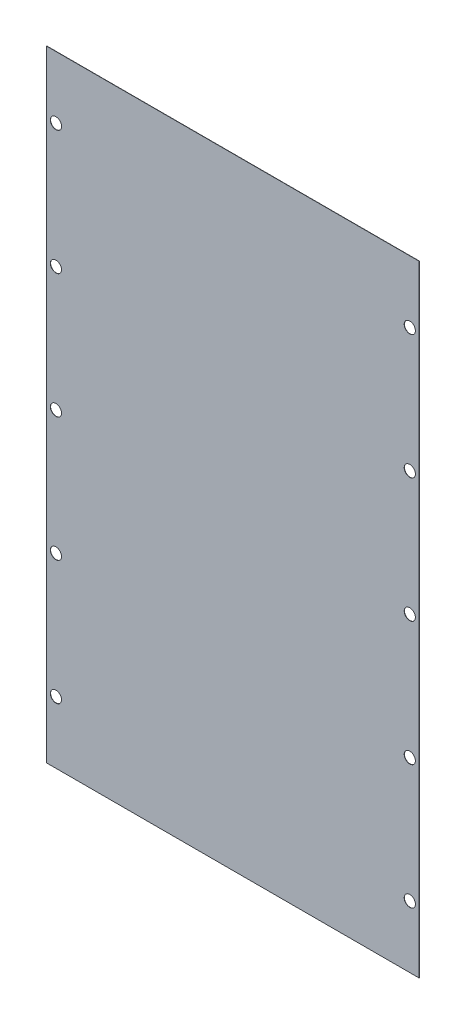
from build123d import *

# Parameters (mm, degrees)
SKETCH1_W                   = 300
SKETCH1_H                   = 500
BOSS_EXTRUDE1_DEPTH         = 0.2
SKETCH2_R                   = 4.499999998
SKETCH2_R_2                 = 4.500000002
M8_CLEARANCE_9MM_THRU_DEPTH = 801.390554667


with BuildPart() as part:
    # Sketch1 → Boss-Extrude1 (new body)
    with BuildSketch(Plane(origin=(0, 0, -0.1), x_dir=(-1, 0, 0), z_dir=(0, 0, -1))):
        with Locations((-475, 250)):
            Rectangle(SKETCH1_W, SKETCH1_H)
    extrude(amount=-BOSS_EXTRUDE1_DEPTH)

    # Sketch2 → M8 clearance - 9mm - thru (cut, through all)
    with BuildSketch(Plane(origin=(0, 0, -0.1), x_dir=(-1, 0, 0), z_dir=(0, 0, -1))):
        with Locations((-332.499999998, 450)):
            Circle(SKETCH2_R)
        with Locations((-332.499999998, 350)):
            Circle(SKETCH2_R)
        with Locations((-332.499999998, 250)):
            Circle(SKETCH2_R)
        with Locations((-332.499999998, 150)):
            Circle(SKETCH2_R)
        with Locations((-332.499999998, 50)):
            Circle(SKETCH2_R)
        with Locations(Location((-617.500000002, 450, 0), (0, 0, 180))):
            Circle(SKETCH2_R_2)
        with Locations(Location((-617.500000002, 350, 0), (0, 0, 180))):
            Circle(SKETCH2_R_2)
        with Locations(Location((-617.500000002, 250, 0), (0, 0, 180))):
            Circle(SKETCH2_R_2)
        with Locations(Location((-617.500000002, 150, 0), (0, 0, 180))):
            Circle(SKETCH2_R_2)
        with Locations(Location((-617.500000002, 50, 0), (0, 0, 180))):
            Circle(SKETCH2_R_2)
    extrude(amount=-M8_CLEARANCE_9MM_THRU_DEPTH, mode=Mode.SUBTRACT)


solid = part.part
